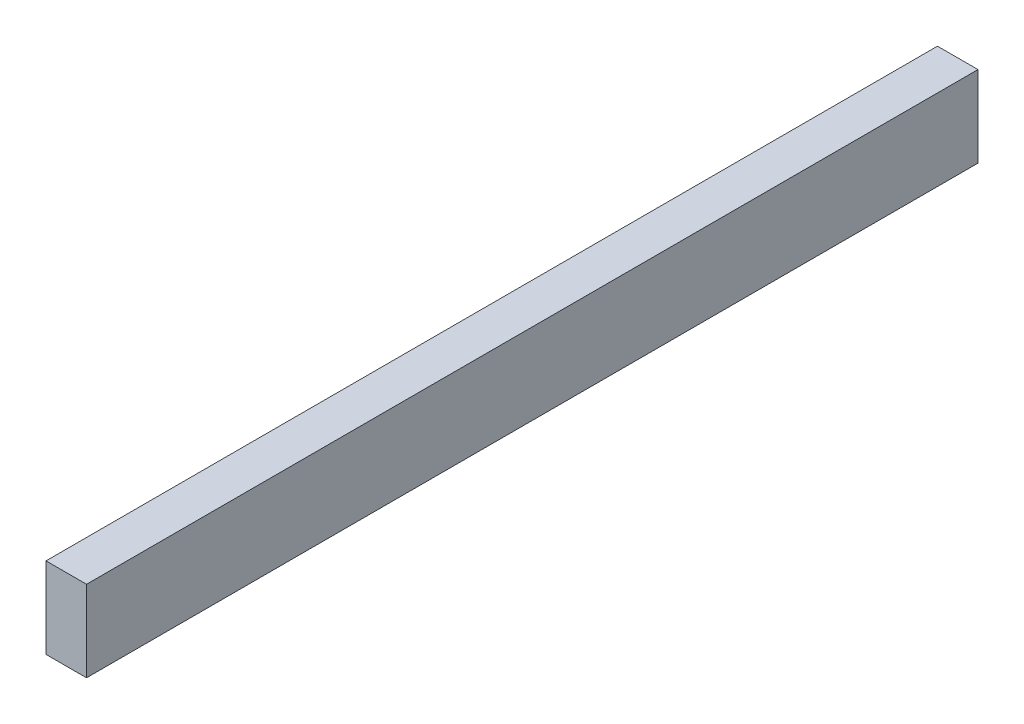
from build123d import *

# Parameters (mm, degrees)
SKETCH1_W           = 25.4
SKETCH1_H           = 558.8
BOSS_EXTRUDE1_DEPTH = 50.8


with BuildPart() as part:
    # Sketch1 → Boss-Extrude1 (new body)
    with BuildSketch(Plane(origin=(0, 0, 0), x_dir=(1, 0, 0), z_dir=(0, 1, 0))):
        Rectangle(SKETCH1_W, SKETCH1_H)
    extrude(amount=BOSS_EXTRUDE1_DEPTH)


solid = part.part
